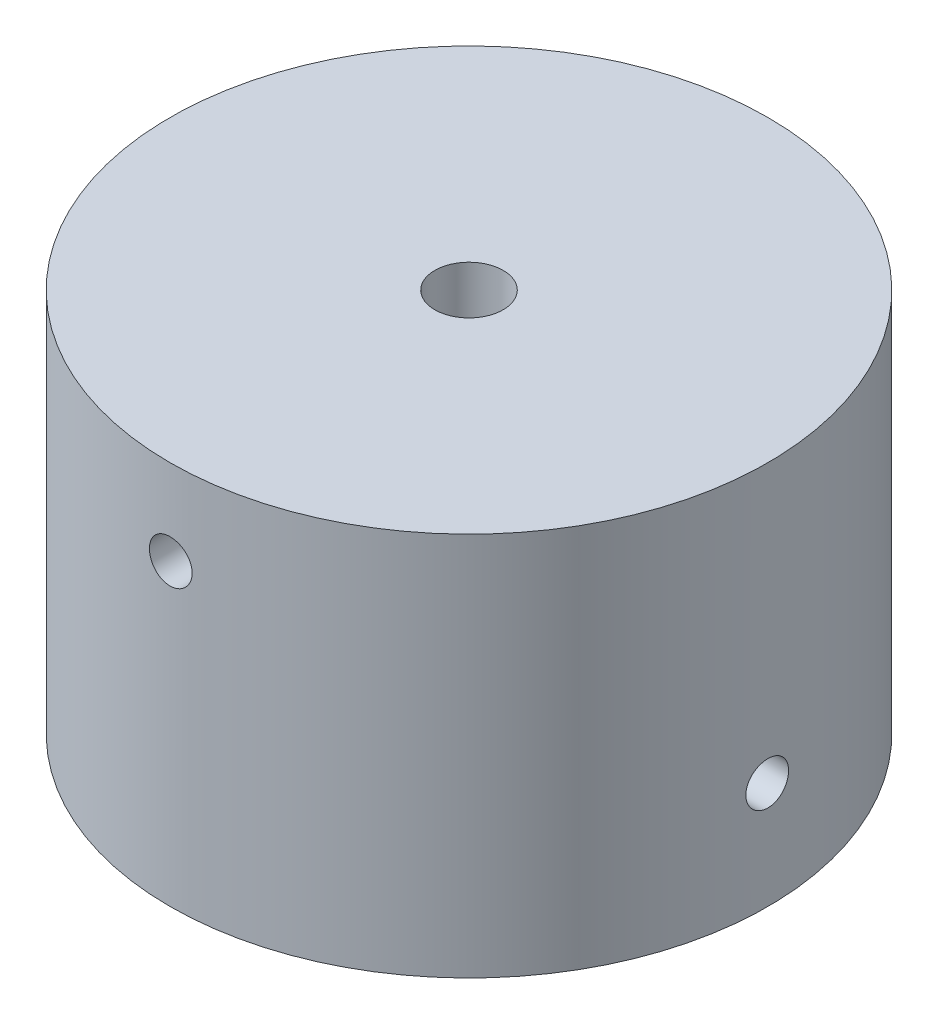
from build123d import *

# Parameters (mm, degrees)
SKETCH1_R               = 14
BOSS_EXTRUDE1_DEPTH     = 18
SKETCH2_R               = 1.6
CUT_EXTRUDE1_DEPTH      = 18
SKETCH3_R               = 4
CUT_EXTRUDE2_DEPTH      = 10
CUT_EXTRUDE3_DEPTH      = 27.758176321
CUT_EXTRUDE3_DEPTH_BACK = 27.758176321
SKETCH4_R               = 1
CUT_EXTRUDE4_DEPTH      = 27.758176497
CUT_EXTRUDE4_DEPTH_BACK = 27.758176497
SKETCH5_R               = 1


with BuildPart() as part:
    # Sketch1 → Boss-Extrude1 (new body)
    with BuildSketch(Plane(origin=(0, 0, 0), x_dir=(1, 0, 0), z_dir=(0, 1, 0))):
        with Locations(Location((0, 0, 0), (0, 0, 270))):
            Circle(SKETCH1_R)
    extrude(amount=BOSS_EXTRUDE1_DEPTH)

    # Sketch2 → Cut-Extrude1 (cut)
    with BuildSketch(Plane(origin=(0, 18, 0), x_dir=(1, 0, 0), z_dir=(0, 1, 0))):
        with Locations(Location((0, 0, 0), (0, 0, 270))):
            Circle(SKETCH2_R)
    extrude(amount=-CUT_EXTRUDE1_DEPTH, mode=Mode.SUBTRACT)

    # Sketch3 → Cut-Extrude2 (cut)
    with BuildSketch(Plane.XZ):
        with Locations(Location((0, 0, 0), (0, 0, 270))):
            Circle(SKETCH3_R)
    extrude(amount=-CUT_EXTRUDE2_DEPTH, mode=Mode.SUBTRACT)

    # Sketch4 → Cut-Extrude3 (cut, two sides: drawn at the far end of the back side and taken through both)
    with BuildSketch(Plane(origin=(0, 0, 0), x_dir=(0, 0, -1), z_dir=(1, 0, 0)).offset(-CUT_EXTRUDE3_DEPTH_BACK)):
        with Locations((0, 5)):
            Circle(SKETCH4_R)
    extrude(amount=CUT_EXTRUDE3_DEPTH + CUT_EXTRUDE3_DEPTH_BACK, mode=Mode.SUBTRACT)

    # Sketch5 → Cut-Extrude4 (cut, two sides: drawn at the far end of the back side and taken through both)
    with BuildSketch(Plane.XY.offset(-CUT_EXTRUDE4_DEPTH_BACK)):
        with Locations(Location((0, 14, 0), (0, 0, 269.999999966))):
            Circle(SKETCH5_R)
    extrude(amount=CUT_EXTRUDE4_DEPTH + CUT_EXTRUDE4_DEPTH_BACK, mode=Mode.SUBTRACT)


solid = part.part
